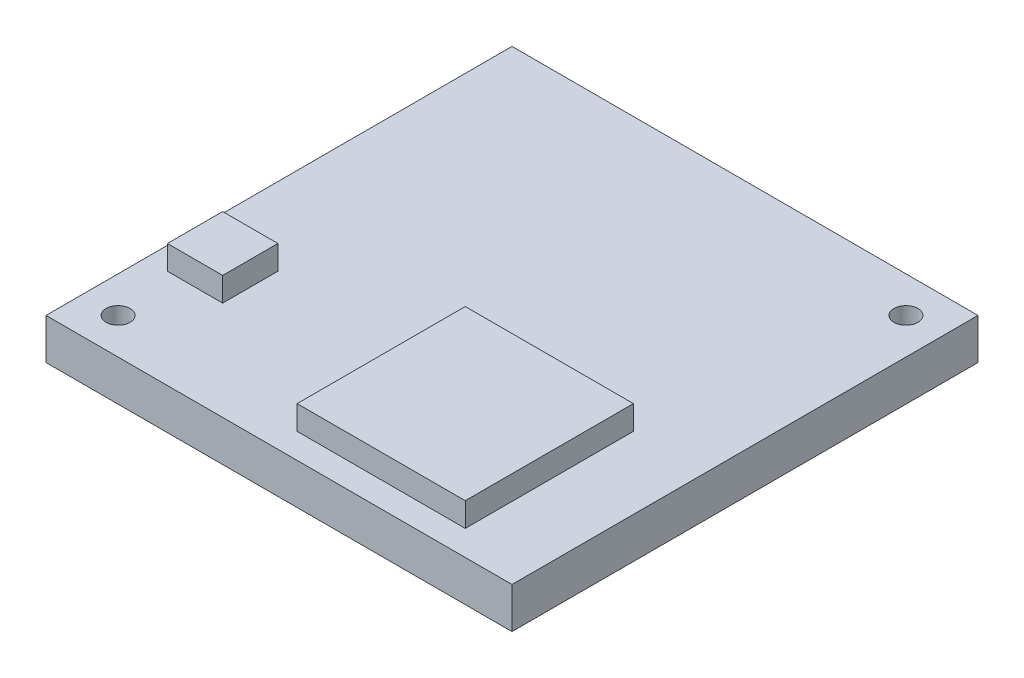
from build123d import *

# Parameters (mm, degrees)
SKETCH1_W           = 19.4
SKETCH1_H           = 19.4
SKETCH1_R           = 0.5
BOSS_EXTRUDE1_DEPTH = 1.7
SKETCH2_W           = 7
SKETCH2_H           = 7
SKETCH2_W_2         = 2.3
SKETCH2_H_2         = 2.3
BOSS_EXTRUDE2_DEPTH = 1


with BuildPart() as part:
    # Sketch1 → Boss-Extrude1 (new body)
    with BuildSketch(Plane(origin=(0, 0, 0), x_dir=(1, 0, 0), z_dir=(0, 1, 0))):
        Rectangle(SKETCH1_W, SKETCH1_H)
        with Locations(Location((-8.2, -8.2, 0), (0, 0, 270))):
            Circle(SKETCH1_R, mode=Mode.SUBTRACT)
        with Locations(Location((8.2, 8.2, 0), (0, 0, 270))):
            Circle(SKETCH1_R, mode=Mode.SUBTRACT)
    extrude(amount=BOSS_EXTRUDE1_DEPTH)

    # Sketch2 → Boss-Extrude2 (add)
    with BuildSketch(Plane(origin=(0, 1.7, 0), x_dir=(1, 0, 0), z_dir=(0, 1, 0))):
        with Locations((3.206065648, -5.151943642)):
            Rectangle(SKETCH2_W, SKETCH2_H)
        with Locations((-7.616722435, -4.429188959)):
            Rectangle(SKETCH2_W_2, SKETCH2_H_2)
    extrude(amount=BOSS_EXTRUDE2_DEPTH)


solid = part.part
